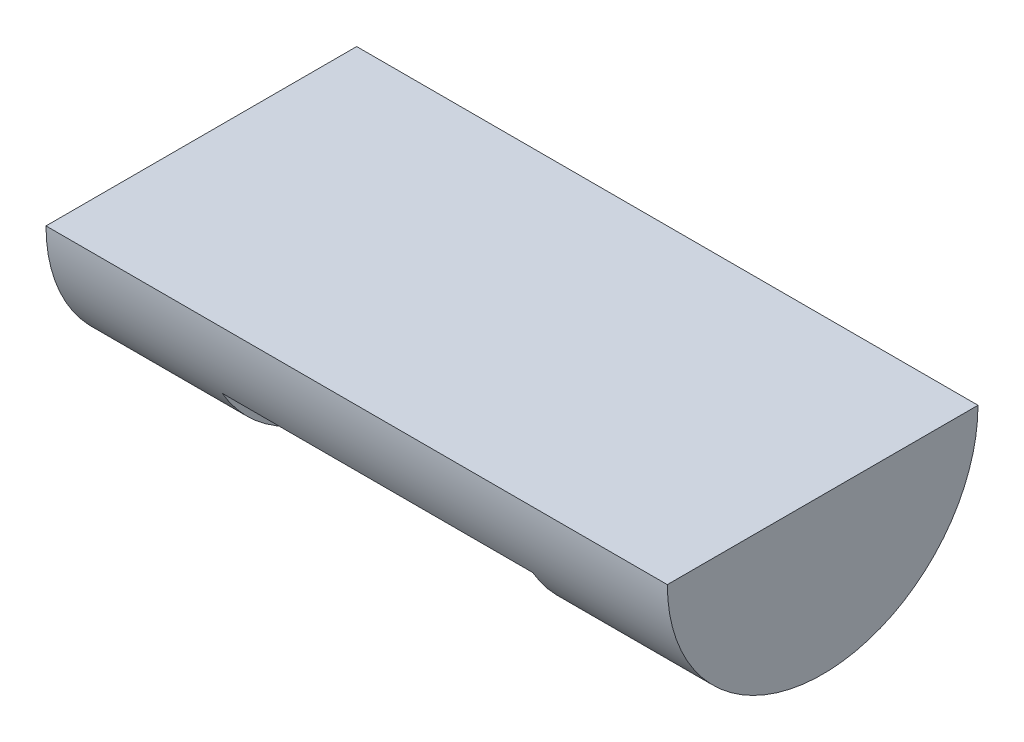
from build123d import *

# Parameters (mm, degrees)
BASE_DEPTH      = 914.4
SLOT_DEPTH      = 940.456694052
SLOT_DEPTH_BACK = 940.456694052
SKETCH2_W       = 304.8
SKETCH2_H       = 76.2
LEFT_CUT_DEPTH  = 152.4


with BuildPart() as part:
    # Sketch1 → Base (new body)
    with BuildSketch(Plane(origin=(0, 0, 0), x_dir=(0, 0, -1), z_dir=(1, 0, 0))):
        with BuildLine():
            Line((152.4, 0), (-152.4, 0))
            ThreePointArc((-152.4, 0), (0, -152.4), (152.4, 0))
        make_face()
    extrude(amount=BASE_DEPTH)

    # Sketch2 → Slot (cut, two sides: drawn at the far end of the back side and taken through both)
    with BuildSketch(Plane.XY.offset(-SLOT_DEPTH_BACK)):
        with Locations((457.2, -114.3)):
            Rectangle(SKETCH2_W, SKETCH2_H)
    extrude(amount=SLOT_DEPTH + SLOT_DEPTH_BACK, mode=Mode.SUBTRACT)

    # Sketch3 → Left Cut (cut)
    with BuildSketch(Plane.ZY):
        with BuildLine():
            Line((152.4, 0), (-152.4, 0))
            ThreePointArc((-152.4, 0), (0, -152.4), (152.4, 0))
        make_face()
    left_cut = extrude(amount=-LEFT_CUT_DEPTH, mode=Mode.SUBTRACT)

    # Right Cut: Left Cut across plane
    add(left_cut.mirror(Plane(origin=(457.2, 0, 0), x_dir=(0, 0, 1), z_dir=(1, 0, 0))), mode=Mode.SUBTRACT)


solid = part.part
